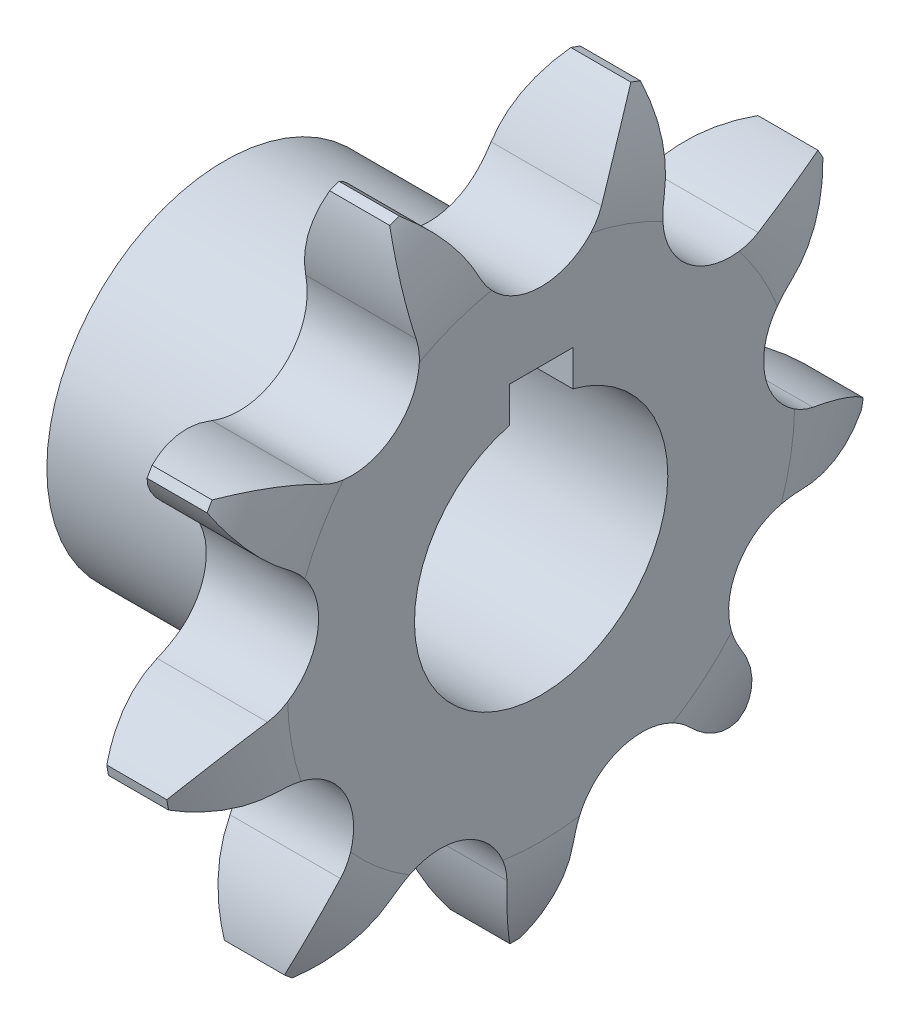
from build123d import *

# Parameters (mm, degrees)
TOOTHCUT_DEPTH     = 25.212835916
TEETHCUTS_COUNT    = 9
TEETHCUTS_ANGLE    = 320
HUBNEAONESKE_R     = 8.409661226
HUBNEARONE_DEPTH   = 16.6809
HUBNEARONEFILLET_R = 0.4
BORSKE_R           = 6
BORE_DEPTH         = 22.0005
SKETCH1_W          = 3
SKETCH1_H          = 3
CUT_EXTRUDE1_DEPTH = 33.16954481
CUT_EXTRUDE2_START = -15
SKETCH2_R          = 22.47858578
CUT_EXTRUDE2_DEPTH = 18.16954481


with BuildPart() as part:
    # BasProSke → Base-Revolve (revolve)
    with BuildSketch(Plane(origin=(0, 0, 0), x_dir=(1, 0, 0), z_dir=(0, 1, 0)), mode=Mode.PRIVATE) as base_revolve_sk:
        with BuildLine():
            Line((0, 0), (0, 12.006866982))
            ThreePointArc((0, 12.006866982), (0.314698702, 14.435029868), (1.238, 16.702743471))
            Line((1.238, 16.702743471), (4.0816, 16.702743471))
            ThreePointArc((4.0816, 16.702743471), (5.004901298, 14.435029868), (5.3196, 12.006866982))
            Line((5.3196, 12.006866982), (5.3196, 0))
            Line((5.3196, 0), (0, 0))
        make_face()
    revolve(base_revolve_sk.sketch.rotate(Axis((-10, 0, 0), (1, 0, 0)), 180), axis=Axis((-10, 0, 0), (1, 0, 0)))

    # TooCutSke → ToothCut (cut, through all)
    with BuildSketch(Plane(origin=(0, 0, 0), x_dir=(0, 0, -1), z_dir=(1, 0, 0))):
        with BuildLine():
            ThreePointArc((2.906302496, 12.60113736), (4.198990076, 14.583034398), (5.994051414, 16.124693193))
            ThreePointArc((5.994051414, 16.124693193), (0, 17.202743471), (-5.994051414, 16.124693193))
            ThreePointArc((-5.994051414, 16.124693193), (-4.198990076, 14.583034398), (-2.906302496, 12.60113736))
            ThreePointArc((-2.906302496, 12.60113736), (0, 10.749618471), (2.906302496, 12.60113736))
        make_face()
    toothcut = extrude(amount=TOOTHCUT_DEPTH, mode=Mode.SUBTRACT)

    # TeethCuts: ToothCut ×9 about axis
    teethcuts_axis = Axis((-10, 0, 0), (1, 0, 0))
    for i in range(1, TEETHCUTS_COUNT):
        add(toothcut.rotate(teethcuts_axis, i * TEETHCUTS_ANGLE / (TEETHCUTS_COUNT - 1)), mode=Mode.SUBTRACT)

    # HubNeaOneSke → HubNearOne (add)
    with BuildSketch(Plane.ZY):
        with Locations(Location((0, 0, 0), (0, 0, 180))):
            Circle(HUBNEAONESKE_R)
    extrude(amount=HUBNEARONE_DEPTH)

    # HubNearOneFillet
    hubnearonefillet_edges = [part.edges().sort_by_distance(p)[0] for p in [
        (0, 0, 8.409661226),
    ]]
    fillet(hubnearonefillet_edges, radius=HUBNEARONEFILLET_R)

    # BorSke → Bore (cut, symmetric)
    with BuildSketch(Plane(origin=(0, 0, 0), x_dir=(0, 0, -1), z_dir=(1, 0, 0))):
        with Locations(Location((0, 0, 0), (0, 0, 180))):
            Circle(BORSKE_R)
    extrude(amount=BORE_DEPTH, both=True, mode=Mode.SUBTRACT)

    # Sketch1 → Cut-Extrude1 (cut, through all)
    with BuildSketch(Plane(origin=(5.3196, 0, 0), x_dir=(0, 0, -1), z_dir=(1, 0, 0))):
        with Locations((0, 6)):
            Rectangle(SKETCH1_W, SKETCH1_H)
    extrude(amount=-CUT_EXTRUDE1_DEPTH, mode=Mode.SUBTRACT)

    # Sketch2 → Cut-Extrude2 (cut, through all)
    with BuildSketch(Plane(origin=(5.3196, 0, 0), x_dir=(0, 0, -1), z_dir=(1, 0, 0)).offset(CUT_EXTRUDE2_START)):
        Circle(SKETCH2_R)
    extrude(amount=-CUT_EXTRUDE2_DEPTH, mode=Mode.SUBTRACT)


solid = part.part
